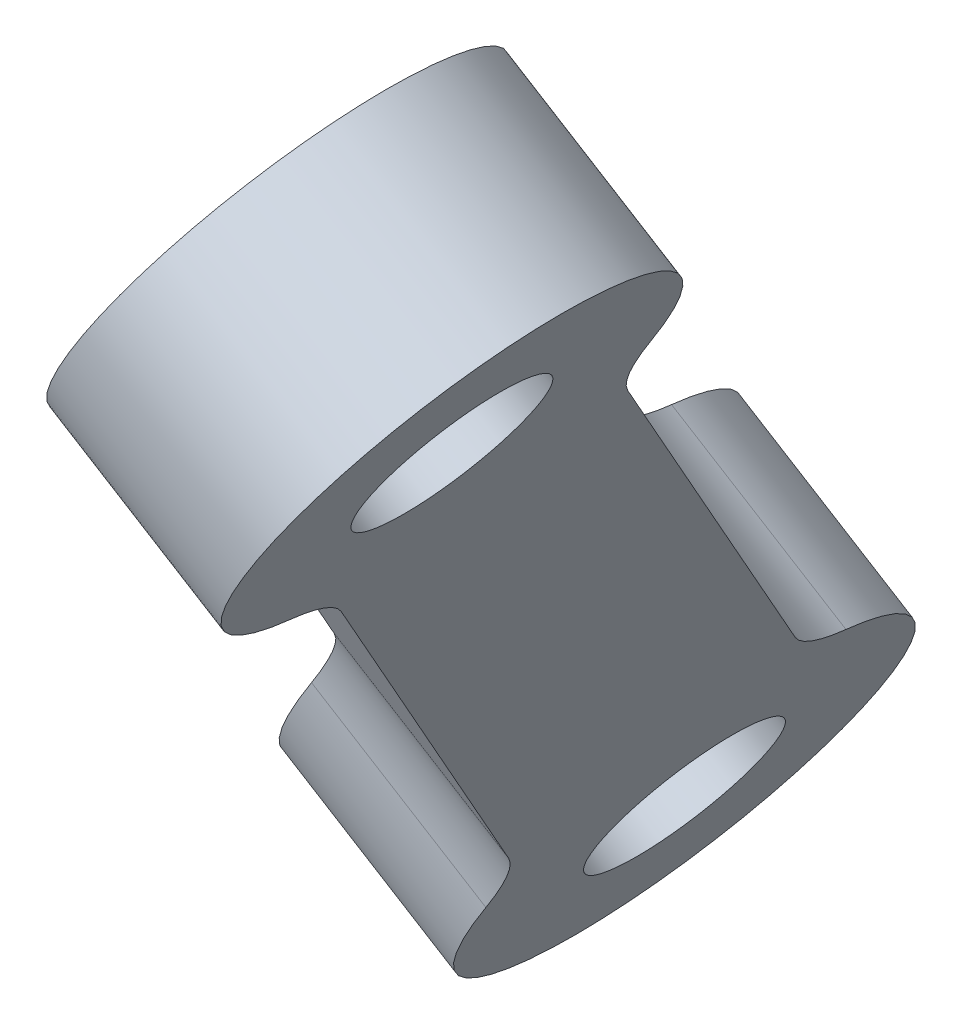
from build123d import *

# Parameters (mm, degrees)
SKETCH1_R           = 1.75
BOSS_EXTRUDE1_DEPTH = 4


with BuildPart() as part:
    # Sketch1 → Boss-Extrude1 (new body)
    with BuildSketch(Plane(origin=(-205.246863596, 127.529053862, 0.603844449), x_dir=(-0.5277644625295511, -0.8493907652493604, 0), z_dir=(-0.8493881131629326, 0.5277628146696668, 0.0024989336654474255))):
        with BuildLine():
            Line((-131.299338375, 83.427603389), (-113.074937533, 70.507252636))
            ThreePointArc((-113.074937533, 70.507252636), (-112.369436859, 69.804495555), (-111.932832634, 68.909523229))
            ThreePointArc((-111.932832634, 68.909523229), (-104.833462851, 67.728923781), (-108.29744513, 74.037306549))
            ThreePointArc((-108.29744513, 74.037306549), (-109.286485291, 74.153057465), (-110.183152018, 74.586171186))
            Line((-110.183152018, 74.586171186), (-128.40755286, 87.50652194))
            ThreePointArc((-128.40755286, 87.50652194), (-129.113053534, 88.20927902), (-129.549657759, 89.104251346))
            ThreePointArc((-129.549657759, 89.104251346), (-136.649027542, 90.284850794), (-133.185045263, 83.976468026))
            ThreePointArc((-133.185045263, 83.976468026), (-132.196005102, 83.86071711), (-131.299338375, 83.427603389))
        make_face()
        with Locations((-133.385892702, 87.971422382)):
            Circle(SKETCH1_R, mode=Mode.SUBTRACT)
        with Locations((-108.096597691, 70.042352193)):
            Circle(SKETCH1_R, mode=Mode.SUBTRACT)
    extrude(amount=-BOSS_EXTRUDE1_DEPTH)


solid = part.part
